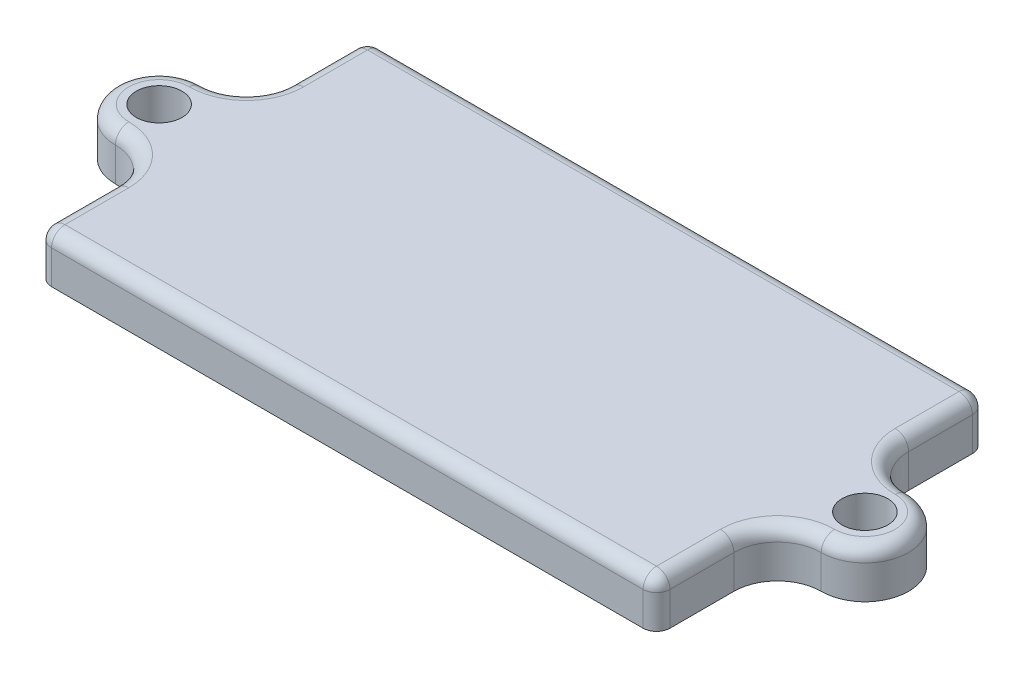
from build123d import *

# Parameters (mm, degrees)
SKETCH_1_R      = 1.7
SKETCH_1_W      = 10
SKETCH_1_H      = 3
SKETCH_1_H_2    = 7
EXTRUDE_1_DEPTH = 1
EXTRUDE_START   = 1
SKETCH_1_3_R    = 1.7
EXTRUDE_2_DEPTH = 1
EXTRUDE_START_2 = 2
SKETCH_1_5_R    = 1.7
EXTRUDE_3_DEPTH = 3
EXTRUDE_START_3 = 7
SKETCH_1_7_R    = 1.7
SKETCH_1_7_W    = 10
SKETCH_1_7_H    = 3
EXTRUDE_4_DEPTH = 2.5
EXTRUDE_START_4 = 9.5
SKETCH_1_9_W    = 10
SKETCH_1_9_H    = 7
SKETCH_1_9_H_2  = 3
SKETCH_1_9_R    = 1.7
EXTRUDE_5_DEPTH = 1
FILLET_1_R      = 1


with BuildPart() as part:
    # Эскиз1 → Бобышка-Вытянуть1 (new body)
    # profile 1 of 9: a face of its own
    with BuildSketch(Plane(origin=(0, 0, 0), x_dir=(1, 0, 0), z_dir=(0, 1, 0))):
        with BuildLine():
            ThreePointArc((-26.25, -3.25), (-23.951902961, -4.201902961), (-23, -6.5))
            Line((-23, -6.5), (-23, 6.5))
            ThreePointArc((-23, 6.5), (-23.951902961, 4.201902961), (-26.25, 3.25))
            ThreePointArc((-26.25, 3.25), (-29.5, 0), (-26.25, -3.25))
        make_face()
        with Locations(Location((-26.25, 0, 0), (0, 0, 270))):
            Circle(SKETCH_1_R, mode=Mode.SUBTRACT)
    # profile 2 of 9: a face of its own
    with BuildSketch(Plane(origin=(0, 0, 0), x_dir=(1, 0, 0), z_dir=(0, 1, 0))):
        with BuildLine():
            Line((20, -12.25), (22, -12.25))
            ThreePointArc((22, -12.25), (22.707106781, -11.957106781), (23, -11.25))
            Line((23, -11.25), (23, -6.5))
            Line((23, -6.5), (23, 6.5))
            Line((23, 6.5), (23, 11.25))
            ThreePointArc((23, 11.25), (22.707106781, 11.957106781), (22, 12.25))
            Line((22, 12.25), (-22, 12.25))
            ThreePointArc((-22, 12.25), (-22.707106781, 11.957106781), (-23, 11.25))
            Line((-23, 11.25), (-23, 6.5))
            Line((-23, 6.5), (-23, -6.5))
            Line((-23, -6.5), (-23, -11.25))
            ThreePointArc((-23, -11.25), (-22.707106781, -11.957106781), (-22, -12.25))
            Line((-22, -12.25), (-11.5, -12.25))
            Line((-11.5, -12.25), (-11.5, -9.25))
            Line((-11.5, -9.25), (-20, -9.25))
            Line((-20, -9.25), (-20, 9.25))
            Line((-20, 9.25), (-1.5, 9.25))
            Line((-1.5, 9.25), (-1.5, -2.25))
            Line((-1.5, -2.25), (-1.5, -9.25))
            Line((-1.5, -9.25), (-1.5, -12.25))
            Line((-1.5, -12.25), (10, -12.25))
            Line((10, -12.25), (10, -9.25))
            Line((10, -9.25), (1.5, -9.25))
            Line((1.5, -9.25), (1.5, 9.25))
            Line((1.5, 9.25), (20, 9.25))
            Line((20, 9.25), (20, -2.25))
            Line((20, -2.25), (20, -9.25))
            Line((20, -9.25), (20, -12.25))
        make_face()
    # profile 3 of 9: a face of its own
    with BuildSketch(Plane(origin=(0, 0, 0), x_dir=(1, 0, 0), z_dir=(0, 1, 0))):
        with Locations((-6.5, -10.75)):
            Rectangle(SKETCH_1_W, SKETCH_1_H)
    # profile 4 of 9: a face of its own
    with BuildSketch(Plane(origin=(0, 0, 0), x_dir=(1, 0, 0), z_dir=(0, 1, 0))):
        with Locations((-6.5, -5.75)):
            Rectangle(SKETCH_1_W, SKETCH_1_H_2)
    # profile 5 of 9: a face of its own
    with BuildSketch(Plane(origin=(0, 0, 0), x_dir=(1, 0, 0), z_dir=(0, 1, 0))):
        Polygon((-20, -9.25), (-11.5, -9.25), (-11.5, -2.25), (-1.5, -2.25), (-1.5, 9.25), (-20, 9.25), align=None)
    # profile 6 of 9: a face of its own
    with BuildSketch(Plane(origin=(0, 0, 0), x_dir=(1, 0, 0), z_dir=(0, 1, 0))):
        Polygon((1.5, -9.25), (10, -9.25), (10, -2.25), (20, -2.25), (20, 9.25), (1.5, 9.25), align=None)
    # profile 7 of 9: a face of its own
    with BuildSketch(Plane(origin=(0, 0, 0), x_dir=(1, 0, 0), z_dir=(0, 1, 0))):
        with Locations((15, -10.75)):
            Rectangle(SKETCH_1_W, SKETCH_1_H)
    # profile 8 of 9: a face of its own
    with BuildSketch(Plane(origin=(0, 0, 0), x_dir=(1, 0, 0), z_dir=(0, 1, 0))):
        with Locations((15, -5.75)):
            Rectangle(SKETCH_1_W, SKETCH_1_H_2)
    # profile 9 of 9: a face of its own
    with BuildSketch(Plane(origin=(0, 0, 0), x_dir=(1, 0, 0), z_dir=(0, 1, 0))):
        with BuildLine():
            Line((23, 6.5), (23, -6.5))
            ThreePointArc((23, -6.5), (23.951902961, -4.201902961), (26.25, -3.25))
            ThreePointArc((26.25, -3.25), (29.5, 0), (26.25, 3.25))
            ThreePointArc((26.25, 3.25), (23.951902961, 4.201902961), (23, 6.5))
        make_face()
        with Locations(Location((26.25, 0, 0), (0, 0, 270))):
            Circle(SKETCH_1_R, mode=Mode.SUBTRACT)
    extrude(amount=EXTRUDE_1_DEPTH)

    # Эскиз1<3> → Бобышка-Вытянуть2 (add)
    # profile 1 of 5: a face of its own
    with BuildSketch(Plane(origin=(0, 0, 0), x_dir=(1, 0, 0), z_dir=(0, 1, 0)).offset(EXTRUDE_START)):
        with BuildLine():
            Line((20, -12.25), (22, -12.25))
            ThreePointArc((22, -12.25), (22.707106781, -11.957106781), (23, -11.25))
            Line((23, -11.25), (23, -6.5))
            Line((23, -6.5), (23, 6.5))
            Line((23, 6.5), (23, 11.25))
            ThreePointArc((23, 11.25), (22.707106781, 11.957106781), (22, 12.25))
            Line((22, 12.25), (-22, 12.25))
            ThreePointArc((-22, 12.25), (-22.707106781, 11.957106781), (-23, 11.25))
            Line((-23, 11.25), (-23, 6.5))
            Line((-23, 6.5), (-23, -6.5))
            Line((-23, -6.5), (-23, -11.25))
            ThreePointArc((-23, -11.25), (-22.707106781, -11.957106781), (-22, -12.25))
            Line((-22, -12.25), (-11.5, -12.25))
            Line((-11.5, -12.25), (-11.5, -9.25))
            Line((-11.5, -9.25), (-20, -9.25))
            Line((-20, -9.25), (-20, 9.25))
            Line((-20, 9.25), (-1.5, 9.25))
            Line((-1.5, 9.25), (-1.5, -2.25))
            Line((-1.5, -2.25), (-1.5, -9.25))
            Line((-1.5, -9.25), (-1.5, -12.25))
            Line((-1.5, -12.25), (10, -12.25))
            Line((10, -12.25), (10, -9.25))
            Line((10, -9.25), (1.5, -9.25))
            Line((1.5, -9.25), (1.5, 9.25))
            Line((1.5, 9.25), (20, 9.25))
            Line((20, 9.25), (20, -2.25))
            Line((20, -2.25), (20, -9.25))
            Line((20, -9.25), (20, -12.25))
        make_face()
    # profile 2 of 5: a face of its own
    with BuildSketch(Plane(origin=(0, 0, 0), x_dir=(1, 0, 0), z_dir=(0, 1, 0)).offset(EXTRUDE_START)):
        Polygon((-20, -9.25), (-11.5, -9.25), (-11.5, -2.25), (-1.5, -2.25), (-1.5, 9.25), (-20, 9.25), align=None)
    # profile 3 of 5: a face of its own
    with BuildSketch(Plane(origin=(0, 0, 0), x_dir=(1, 0, 0), z_dir=(0, 1, 0)).offset(EXTRUDE_START)):
        with BuildLine():
            ThreePointArc((-26.25, -3.25), (-23.951902961, -4.201902961), (-23, -6.5))
            Line((-23, -6.5), (-23, 6.5))
            ThreePointArc((-23, 6.5), (-23.951902961, 4.201902961), (-26.25, 3.25))
            ThreePointArc((-26.25, 3.25), (-29.5, 0), (-26.25, -3.25))
        make_face()
        with Locations(Location((-26.25, 0, 0), (0, 0, 270))):
            Circle(SKETCH_1_3_R, mode=Mode.SUBTRACT)
    # profile 4 of 5: a face of its own
    with BuildSketch(Plane(origin=(0, 0, 0), x_dir=(1, 0, 0), z_dir=(0, 1, 0)).offset(EXTRUDE_START)):
        Polygon((1.5, -9.25), (10, -9.25), (10, -2.25), (20, -2.25), (20, 9.25), (1.5, 9.25), align=None)
    # profile 5 of 5: a face of its own
    with BuildSketch(Plane(origin=(0, 0, 0), x_dir=(1, 0, 0), z_dir=(0, 1, 0)).offset(EXTRUDE_START)):
        with BuildLine():
            Line((23, 6.5), (23, -6.5))
            ThreePointArc((23, -6.5), (23.951902961, -4.201902961), (26.25, -3.25))
            ThreePointArc((26.25, -3.25), (29.5, 0), (26.25, 3.25))
            ThreePointArc((26.25, 3.25), (23.951902961, 4.201902961), (23, 6.5))
        make_face()
        with Locations(Location((26.25, 0, 0), (0, 0, 270))):
            Circle(SKETCH_1_3_R, mode=Mode.SUBTRACT)
    extrude(amount=EXTRUDE_2_DEPTH)

    # Эскиз1<5> → Бобышка-Вытянуть3 (add)
    # profile 1 of 3: a face of its own
    with BuildSketch(Plane(origin=(0, 0, 0), x_dir=(1, 0, 0), z_dir=(0, 1, 0)).offset(EXTRUDE_START_2)):
        with BuildLine():
            Line((20, -12.25), (22, -12.25))
            ThreePointArc((22, -12.25), (22.707106781, -11.957106781), (23, -11.25))
            Line((23, -11.25), (23, -6.5))
            Line((23, -6.5), (23, 6.5))
            Line((23, 6.5), (23, 11.25))
            ThreePointArc((23, 11.25), (22.707106781, 11.957106781), (22, 12.25))
            Line((22, 12.25), (-22, 12.25))
            ThreePointArc((-22, 12.25), (-22.707106781, 11.957106781), (-23, 11.25))
            Line((-23, 11.25), (-23, 6.5))
            Line((-23, 6.5), (-23, -6.5))
            Line((-23, -6.5), (-23, -11.25))
            ThreePointArc((-23, -11.25), (-22.707106781, -11.957106781), (-22, -12.25))
            Line((-22, -12.25), (-11.5, -12.25))
            Line((-11.5, -12.25), (-11.5, -9.25))
            Line((-11.5, -9.25), (-20, -9.25))
            Line((-20, -9.25), (-20, 9.25))
            Line((-20, 9.25), (-1.5, 9.25))
            Line((-1.5, 9.25), (-1.5, -2.25))
            Line((-1.5, -2.25), (-1.5, -9.25))
            Line((-1.5, -9.25), (-1.5, -12.25))
            Line((-1.5, -12.25), (10, -12.25))
            Line((10, -12.25), (10, -9.25))
            Line((10, -9.25), (1.5, -9.25))
            Line((1.5, -9.25), (1.5, 9.25))
            Line((1.5, 9.25), (20, 9.25))
            Line((20, 9.25), (20, -2.25))
            Line((20, -2.25), (20, -9.25))
            Line((20, -9.25), (20, -12.25))
        make_face()
    # profile 2 of 3: a face of its own
    with BuildSketch(Plane(origin=(0, 0, 0), x_dir=(1, 0, 0), z_dir=(0, 1, 0)).offset(EXTRUDE_START_2)):
        with BuildLine():
            ThreePointArc((-26.25, -3.25), (-23.951902961, -4.201902961), (-23, -6.5))
            Line((-23, -6.5), (-23, 6.5))
            ThreePointArc((-23, 6.5), (-23.951902961, 4.201902961), (-26.25, 3.25))
            ThreePointArc((-26.25, 3.25), (-29.5, 0), (-26.25, -3.25))
        make_face()
        with Locations(Location((-26.25, 0, 0), (0, 0, 270))):
            Circle(SKETCH_1_5_R, mode=Mode.SUBTRACT)
    # profile 3 of 3: a face of its own
    with BuildSketch(Plane(origin=(0, 0, 0), x_dir=(1, 0, 0), z_dir=(0, 1, 0)).offset(EXTRUDE_START_2)):
        with BuildLine():
            Line((23, 6.5), (23, -6.5))
            ThreePointArc((23, -6.5), (23.951902961, -4.201902961), (26.25, -3.25))
            ThreePointArc((26.25, -3.25), (29.5, 0), (26.25, 3.25))
            ThreePointArc((26.25, 3.25), (23.951902961, 4.201902961), (23, 6.5))
        make_face()
        with Locations(Location((26.25, 0, 0), (0, 0, 270))):
            Circle(SKETCH_1_5_R, mode=Mode.SUBTRACT)
    extrude(amount=EXTRUDE_3_DEPTH)


with BuildPart() as body_2:
    # Эскиз1<7> → Бобышка-Вытянуть4 (new body)
    # profile 1 of 5: a face of its own
    with BuildSketch(Plane(origin=(0, 0, 0), x_dir=(1, 0, 0), z_dir=(0, 1, 0)).offset(EXTRUDE_START_3)):
        with BuildLine():
            Line((20, -12.25), (22, -12.25))
            ThreePointArc((22, -12.25), (22.707106781, -11.957106781), (23, -11.25))
            Line((23, -11.25), (23, -6.5))
            Line((23, -6.5), (23, 6.5))
            Line((23, 6.5), (23, 11.25))
            ThreePointArc((23, 11.25), (22.707106781, 11.957106781), (22, 12.25))
            Line((22, 12.25), (-22, 12.25))
            ThreePointArc((-22, 12.25), (-22.707106781, 11.957106781), (-23, 11.25))
            Line((-23, 11.25), (-23, 6.5))
            Line((-23, 6.5), (-23, -6.5))
            Line((-23, -6.5), (-23, -11.25))
            ThreePointArc((-23, -11.25), (-22.707106781, -11.957106781), (-22, -12.25))
            Line((-22, -12.25), (-11.5, -12.25))
            Line((-11.5, -12.25), (-11.5, -9.25))
            Line((-11.5, -9.25), (-20, -9.25))
            Line((-20, -9.25), (-20, 9.25))
            Line((-20, 9.25), (-1.5, 9.25))
            Line((-1.5, 9.25), (-1.5, -2.25))
            Line((-1.5, -2.25), (-1.5, -9.25))
            Line((-1.5, -9.25), (-1.5, -12.25))
            Line((-1.5, -12.25), (10, -12.25))
            Line((10, -12.25), (10, -9.25))
            Line((10, -9.25), (1.5, -9.25))
            Line((1.5, -9.25), (1.5, 9.25))
            Line((1.5, 9.25), (20, 9.25))
            Line((20, 9.25), (20, -2.25))
            Line((20, -2.25), (20, -9.25))
            Line((20, -9.25), (20, -12.25))
        make_face()
    # profile 2 of 5: a face of its own
    with BuildSketch(Plane(origin=(0, 0, 0), x_dir=(1, 0, 0), z_dir=(0, 1, 0)).offset(EXTRUDE_START_3)):
        with BuildLine():
            ThreePointArc((-26.25, -3.25), (-23.951902961, -4.201902961), (-23, -6.5))
            Line((-23, -6.5), (-23, 6.5))
            ThreePointArc((-23, 6.5), (-23.951902961, 4.201902961), (-26.25, 3.25))
            ThreePointArc((-26.25, 3.25), (-29.5, 0), (-26.25, -3.25))
        make_face()
        with Locations(Location((-26.25, 0, 0), (0, 0, 270))):
            Circle(SKETCH_1_7_R, mode=Mode.SUBTRACT)
    # profile 3 of 5: a face of its own
    with BuildSketch(Plane(origin=(0, 0, 0), x_dir=(1, 0, 0), z_dir=(0, 1, 0)).offset(EXTRUDE_START_3)):
        with BuildLine():
            Line((23, 6.5), (23, -6.5))
            ThreePointArc((23, -6.5), (23.951902961, -4.201902961), (26.25, -3.25))
            ThreePointArc((26.25, -3.25), (29.5, 0), (26.25, 3.25))
            ThreePointArc((26.25, 3.25), (23.951902961, 4.201902961), (23, 6.5))
        make_face()
        with Locations(Location((26.25, 0, 0), (0, 0, 270))):
            Circle(SKETCH_1_7_R, mode=Mode.SUBTRACT)
    # profile 4 of 5: a face of its own
    with BuildSketch(Plane(origin=(0, 0, 0), x_dir=(1, 0, 0), z_dir=(0, 1, 0)).offset(EXTRUDE_START_3)):
        with Locations((-6.5, -10.75)):
            Rectangle(SKETCH_1_7_W, SKETCH_1_7_H)
    # profile 5 of 5: a face of its own
    with BuildSketch(Plane(origin=(0, 0, 0), x_dir=(1, 0, 0), z_dir=(0, 1, 0)).offset(EXTRUDE_START_3)):
        with Locations((15, -10.75)):
            Rectangle(SKETCH_1_7_W, SKETCH_1_7_H)
    extrude(amount=EXTRUDE_4_DEPTH)

    # Эскиз1<9> → Бобышка-Вытянуть5 (add)
    # profile 1 of 9: a face of its own
    with BuildSketch(Plane(origin=(0, 0, 0), x_dir=(1, 0, 0), z_dir=(0, 1, 0)).offset(EXTRUDE_START_4)):
        Polygon((-20, -9.25), (-11.5, -9.25), (-11.5, -2.25), (-1.5, -2.25), (-1.5, 9.25), (-20, 9.25), align=None)
    # profile 2 of 9: a face of its own
    with BuildSketch(Plane(origin=(0, 0, 0), x_dir=(1, 0, 0), z_dir=(0, 1, 0)).offset(EXTRUDE_START_4)):
        Polygon((1.5, -9.25), (10, -9.25), (10, -2.25), (20, -2.25), (20, 9.25), (1.5, 9.25), align=None)
    # profile 3 of 9: a face of its own
    with BuildSketch(Plane(origin=(0, 0, 0), x_dir=(1, 0, 0), z_dir=(0, 1, 0)).offset(EXTRUDE_START_4)):
        with Locations((15, -5.75)):
            Rectangle(SKETCH_1_9_W, SKETCH_1_9_H)
    # profile 4 of 9: a face of its own
    with BuildSketch(Plane(origin=(0, 0, 0), x_dir=(1, 0, 0), z_dir=(0, 1, 0)).offset(EXTRUDE_START_4)):
        with Locations((15, -10.75)):
            Rectangle(SKETCH_1_9_W, SKETCH_1_9_H_2)
    # profile 5 of 9: a face of its own
    with BuildSketch(Plane(origin=(0, 0, 0), x_dir=(1, 0, 0), z_dir=(0, 1, 0)).offset(EXTRUDE_START_4)):
        with Locations((-6.5, -10.75)):
            Rectangle(SKETCH_1_9_W, SKETCH_1_9_H_2)
    # profile 6 of 9: a face of its own
    with BuildSketch(Plane(origin=(0, 0, 0), x_dir=(1, 0, 0), z_dir=(0, 1, 0)).offset(EXTRUDE_START_4)):
        with Locations((-6.5, -5.75)):
            Rectangle(SKETCH_1_9_W, SKETCH_1_9_H)
    # profile 7 of 9: a face of its own
    with BuildSketch(Plane(origin=(0, 0, 0), x_dir=(1, 0, 0), z_dir=(0, 1, 0)).offset(EXTRUDE_START_4)):
        with BuildLine():
            Line((20, -12.25), (22, -12.25))
            ThreePointArc((22, -12.25), (22.707106781, -11.957106781), (23, -11.25))
            Line((23, -11.25), (23, -6.5))
            Line((23, -6.5), (23, 6.5))
            Line((23, 6.5), (23, 11.25))
            ThreePointArc((23, 11.25), (22.707106781, 11.957106781), (22, 12.25))
            Line((22, 12.25), (-22, 12.25))
            ThreePointArc((-22, 12.25), (-22.707106781, 11.957106781), (-23, 11.25))
            Line((-23, 11.25), (-23, 6.5))
            Line((-23, 6.5), (-23, -6.5))
            Line((-23, -6.5), (-23, -11.25))
            ThreePointArc((-23, -11.25), (-22.707106781, -11.957106781), (-22, -12.25))
            Line((-22, -12.25), (-11.5, -12.25))
            Line((-11.5, -12.25), (-11.5, -9.25))
            Line((-11.5, -9.25), (-20, -9.25))
            Line((-20, -9.25), (-20, 9.25))
            Line((-20, 9.25), (-1.5, 9.25))
            Line((-1.5, 9.25), (-1.5, -2.25))
            Line((-1.5, -2.25), (-1.5, -9.25))
            Line((-1.5, -9.25), (-1.5, -12.25))
            Line((-1.5, -12.25), (10, -12.25))
            Line((10, -12.25), (10, -9.25))
            Line((10, -9.25), (1.5, -9.25))
            Line((1.5, -9.25), (1.5, 9.25))
            Line((1.5, 9.25), (20, 9.25))
            Line((20, 9.25), (20, -2.25))
            Line((20, -2.25), (20, -9.25))
            Line((20, -9.25), (20, -12.25))
        make_face()
    # profile 8 of 9: a face of its own
    with BuildSketch(Plane(origin=(0, 0, 0), x_dir=(1, 0, 0), z_dir=(0, 1, 0)).offset(EXTRUDE_START_4)):
        with BuildLine():
            Line((23, 6.5), (23, -6.5))
            ThreePointArc((23, -6.5), (23.951902961, -4.201902961), (26.25, -3.25))
            ThreePointArc((26.25, -3.25), (29.5, 0), (26.25, 3.25))
            ThreePointArc((26.25, 3.25), (23.951902961, 4.201902961), (23, 6.5))
        make_face()
        with Locations(Location((26.25, 0, 0), (0, 0, 270))):
            Circle(SKETCH_1_9_R, mode=Mode.SUBTRACT)
    # profile 9 of 9: a face of its own
    with BuildSketch(Plane(origin=(0, 0, 0), x_dir=(1, 0, 0), z_dir=(0, 1, 0)).offset(EXTRUDE_START_4)):
        with BuildLine():
            ThreePointArc((-26.25, -3.25), (-23.951902961, -4.201902961), (-23, -6.5))
            Line((-23, -6.5), (-23, 6.5))
            ThreePointArc((-23, 6.5), (-23.951902961, 4.201902961), (-26.25, 3.25))
            ThreePointArc((-26.25, 3.25), (-29.5, 0), (-26.25, -3.25))
        make_face()
        with Locations(Location((-26.25, 0, 0), (0, 0, 270))):
            Circle(SKETCH_1_9_R, mode=Mode.SUBTRACT)
    extrude(amount=EXTRUDE_5_DEPTH)

    # Скругление1
    fillet_1_edges = [body_2.edges().sort_by_distance(p)[0] for p in [
        (-22.707106781, 10.5, 11.957106781),
        (-23, 10.5, 8.875),
        (-23.951902961, 10.5, 4.201902961),
        (-29.5, 10.5, 0),
        (-23.951902961, 10.5, -4.201902961),
        (-22.707106781, 10.5, -11.957106781),
        (0, 10.5, -12.25),
        (22.707106781, 10.5, -11.957106781),
        (23, 10.5, -8.875),
        (23.951902961, 10.5, -4.201902961),
        (29.5, 10.5, 0),
        (23.951902961, 10.5, 4.201902961),
        (23, 10.5, 8.875),
        (22.707106781, 10.5, 11.957106781),
        (0, 10.5, 12.25),
    ]]
    fillet(fillet_1_edges, radius=FILLET_1_R)


solid = body_2.part
